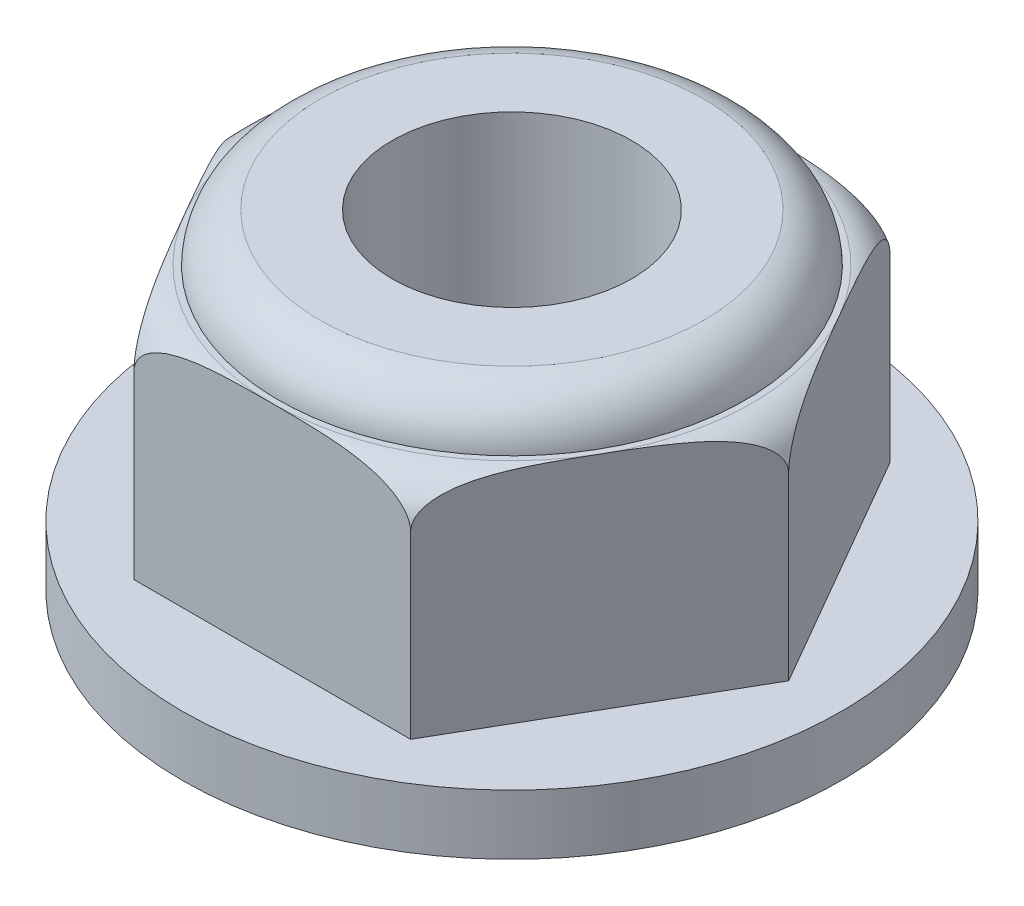
from build123d import *

# Parameters (mm, degrees)
SKETCH_1_R      = 5.5
SKETCH_1_R_2    = 2
EXTRUDE_1_DEPTH = 1
SKETCH_2_R      = 2
EXTRUDE_2_DEPTH = 4.5


with BuildPart() as part:
    # 草图1 → 凸台-拉伸1 (new body)
    with BuildSketch(Plane(origin=(0, 0, 0), x_dir=(1, 0, 0), z_dir=(0, 1, 0))):
        with Locations(Location((0, 0, 0), (0, 0, 270))):
            Circle(SKETCH_1_R)
        with Locations(Location((0, 0, 0), (0, 0, 270))):
            Circle(SKETCH_1_R_2, mode=Mode.SUBTRACT)
    extrude(amount=EXTRUDE_1_DEPTH)

    # 草图2 → 凸台-拉伸2 (add)
    with BuildSketch(Plane(origin=(0, 1, 0), x_dir=(1, 0, 0), z_dir=(0, 1, 0))):
        Polygon((4.618802154, 0), (2.309401077, 4), (-2.309401077, 4), (-4.618802154, 0), (-2.309401077, -4), (2.309401077, -4), align=None)
        with Locations(Location((0, 0, 0), (0, 0, 270))):
            Circle(SKETCH_2_R, mode=Mode.SUBTRACT)
    extrude(amount=EXTRUDE_2_DEPTH)

    # 草图3 → 切除-旋转1 (revolve, cut)
    with BuildSketch(Plane.XY):
        with BuildLine():
            ThreePointArc((-3.2, 5.5), (-3.686821507, 5.219718819), (-3.9, 4.7))
            Line((-3.9, 4.7), (-4, 4.7))
            ThreePointArc((-4, 4.7), (-4.441923124, 4.467149897), (-4.618802154, 4))
            Line((-4.618802154, 4), (-4.618802154, 5.5))
            Line((-4.618802154, 5.5), (-3.2, 5.5))
        make_face()
    revolve(axis=Axis((0, 5.5, 0), (0, -1, 0)), mode=Mode.SUBTRACT)


solid = part.part
